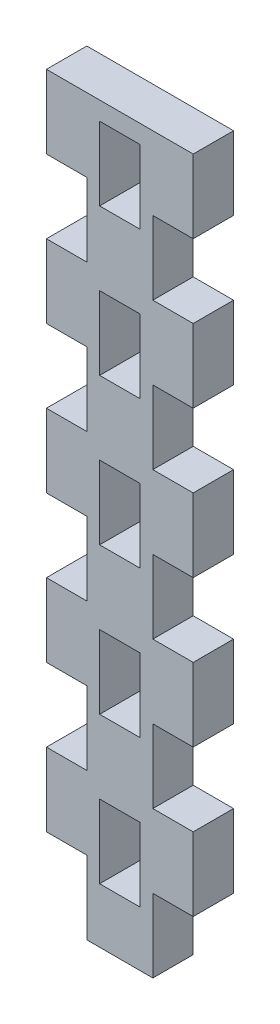
from build123d import *

# Parameters (mm, degrees)
SKETCH_1_W          = 20
SKETCH_1_H          = 100
EXTRUDE_1_DEPTH     = 5.5
SKETCH_2_W          = 5.5
SKETCH_2_H          = 10
CUT_EXTRUDE_1_DEPTH = 52.285962992
SKETCH_3_W          = 5.5
SKETCH_3_H          = 10
CUT_EXTRUDE_2_DEPTH = 52.285962992


with BuildPart() as part:
    # ｽｹｯﾁ1 → ﾎﾞｽ - 押し出し1 (new body)
    with BuildSketch(Plane.XY):
        Rectangle(SKETCH_1_W, SKETCH_1_H)
    extrude(amount=EXTRUDE_1_DEPTH)

    # ｽｹｯﾁ2 → ｶｯﾄ - 押し出し1 (cut, through all)
    with BuildSketch(Plane.XY.offset(5.5)):
        with Locations((-7.25, 35)):
            Rectangle(SKETCH_2_W, SKETCH_2_H)
        with Locations((-7.25, 15)):
            Rectangle(SKETCH_2_W, SKETCH_2_H)
        with Locations((-7.25, -5)):
            Rectangle(SKETCH_2_W, SKETCH_2_H)
        with Locations((-7.25, -25)):
            Rectangle(SKETCH_2_W, SKETCH_2_H)
        with Locations((7.25, -25)):
            Rectangle(SKETCH_2_W, SKETCH_2_H)
        with Locations((7.25, -5)):
            Rectangle(SKETCH_2_W, SKETCH_2_H)
        with Locations((7.25, 15)):
            Rectangle(SKETCH_2_W, SKETCH_2_H)
        with Locations((7.25, 35)):
            Rectangle(SKETCH_2_W, SKETCH_2_H)
        with Locations((-7.25, -45)):
            Rectangle(SKETCH_2_W, SKETCH_2_H)
        with Locations((7.25, -45)):
            Rectangle(SKETCH_2_W, SKETCH_2_H)
    extrude(amount=-CUT_EXTRUDE_1_DEPTH, mode=Mode.SUBTRACT)

    # ｽｹｯﾁ3 → ｶｯﾄ - 押し出し2 (cut, through all)
    with BuildSketch(Plane.XY.offset(5.5)):
        with Locations((0, -37.5)):
            Rectangle(SKETCH_3_W, SKETCH_3_H)
        with Locations((0, -17.5)):
            Rectangle(SKETCH_3_W, SKETCH_3_H)
        with Locations((0, 2.5)):
            Rectangle(SKETCH_3_W, SKETCH_3_H)
        with Locations((0, 22.5)):
            Rectangle(SKETCH_3_W, SKETCH_3_H)
        with Locations((0, 42.5)):
            Rectangle(SKETCH_3_W, SKETCH_3_H)
    extrude(amount=-CUT_EXTRUDE_2_DEPTH, mode=Mode.SUBTRACT)


solid = part.part
